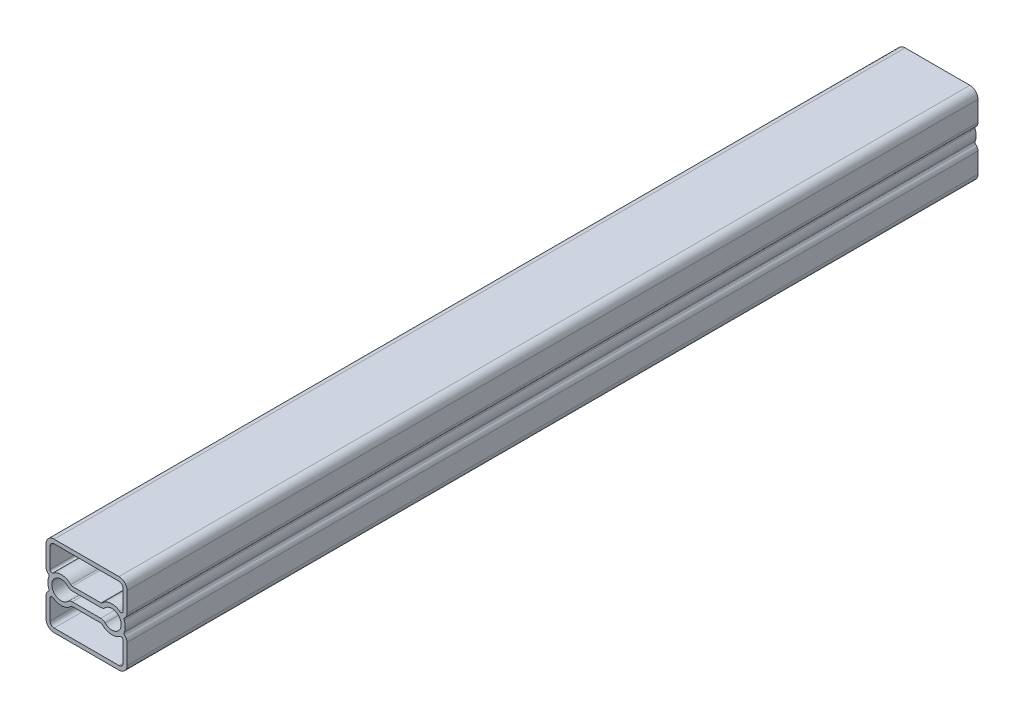
from build123d import *

# Parameters (mm, degrees)
BOSS_EXTRUDE1_DEPTH = 266.7


with BuildPart() as part:
    # Sketch1 → Boss-Extrude1 (new body)
    with BuildSketch(Plane.XY):
        with BuildLine():
            Line((12.7, 3.904831807), (12.7, 10.16))
            ThreePointArc((12.7, 10.16), (11.956051224, 11.956051224), (10.16, 12.7))
            Line((10.16, 12.7), (-10.16, 12.7))
            ThreePointArc((-10.16, 12.7), (-11.956051224, 11.956051224), (-12.7, 10.16))
            Line((-12.7, 10.16), (-12.7, 3.904831807))
            ThreePointArc((-12.7, 3.904831807), (-12.511460601, 3.078521934), (-11.983162199, 2.415773182))
            ThreePointArc((-11.983162199, 2.415773182), (-11.763134535, 2.073265365), (-11.796313868, 1.667527878))
            ThreePointArc((-11.796313868, 1.667527878), (-12.1412, 0), (-11.796313868, -1.667527878))
            ThreePointArc((-11.796313868, -1.667527878), (-11.763134535, -2.073265365), (-11.983162199, -2.415773182))
            ThreePointArc((-11.983162199, -2.415773182), (-12.511460601, -3.078521934), (-12.7, -3.904831807))
            Line((-12.7, -3.904831807), (-12.7, -10.16))
            ThreePointArc((-12.7, -10.16), (-11.956051224, -11.956051224), (-10.16, -12.7))
            Line((-10.16, -12.7), (10.16, -12.7))
            ThreePointArc((10.16, -12.7), (11.956051224, -11.956051224), (12.7, -10.16))
            Line((12.7, -10.16), (12.7, -3.904831807))
            ThreePointArc((12.7, -3.904831807), (12.511460601, -3.078521934), (11.983162199, -2.415773182))
            ThreePointArc((11.983162199, -2.415773182), (11.763134535, -2.073265365), (11.796313868, -1.667527878))
            ThreePointArc((11.796313868, -1.667527878), (12.1412, 0), (11.796313868, 1.667527878))
            ThreePointArc((11.796313868, 1.667527878), (11.763134535, 2.073265365), (11.983162199, 2.415773182))
            ThreePointArc((11.983162199, 2.415773182), (12.511460601, 3.078521934), (12.7, 3.904831807))
        make_face()
        with BuildLine():
            Line((4.467104451, -1.46685), (-4.467104451, -1.46685))
            ThreePointArc((-4.467104451, -1.46685), (-5.208770649, -1.617154514), (-5.833401911, -2.04435))
            ThreePointArc((-5.833401911, -2.04435), (-10.8712, 0), (-5.833401911, 2.04435))
            ThreePointArc((-5.833401911, 2.04435), (-5.208770649, 1.617154514), (-4.467104451, 1.46685))
            Line((-4.467104451, 1.46685), (4.467104451, 1.46685))
            ThreePointArc((4.467104451, 1.46685), (5.208770649, 1.617154514), (5.833401911, 2.04435))
            ThreePointArc((5.833401911, 2.04435), (10.8712, 0), (5.833401911, -2.04435))
            ThreePointArc((5.833401911, -2.04435), (5.208770649, -1.617154514), (4.467104451, -1.46685))
        make_face(mode=Mode.SUBTRACT)
        with BuildLine():
            Line((11.43, 10.16), (11.43, 3.904831807))
            ThreePointArc((11.43, 3.904831807), (11.082315158, 3.338550075), (10.42, 3.392386688))
            ThreePointArc((10.42, 3.392386688), (7.584682807, 4.188867833), (4.922536938, 2.92935))
            ThreePointArc((4.922536938, 2.92935), (4.714326517, 2.786951505), (4.467104451, 2.73685))
            Line((4.467104451, 2.73685), (-4.467104451, 2.73685))
            ThreePointArc((-4.467104451, 2.73685), (-4.714326517, 2.786951505), (-4.922536938, 2.92935))
            ThreePointArc((-4.922536938, 2.92935), (-7.584682807, 4.188867833), (-10.42, 3.392386688))
            ThreePointArc((-10.42, 3.392386688), (-11.082315158, 3.338550075), (-11.43, 3.904831807))
            Line((-11.43, 3.904831807), (-11.43, 10.16))
            ThreePointArc((-11.43, 10.16), (-11.058025612, 11.058025612), (-10.16, 11.43))
            Line((-10.16, 11.43), (10.16, 11.43))
            ThreePointArc((10.16, 11.43), (11.058025612, 11.058025612), (11.43, 10.16))
        make_face(mode=Mode.SUBTRACT)
        with BuildLine():
            Line((11.43, -3.904831807), (11.43, -10.16))
            ThreePointArc((11.43, -10.16), (11.058025612, -11.058025612), (10.16, -11.43))
            Line((10.16, -11.43), (-10.16, -11.43))
            ThreePointArc((-10.16, -11.43), (-11.058025612, -11.058025612), (-11.43, -10.16))
            Line((-11.43, -10.16), (-11.43, -3.904831807))
            ThreePointArc((-11.43, -3.904831807), (-11.082315158, -3.338550075), (-10.42, -3.392386688))
            ThreePointArc((-10.42, -3.392386688), (-7.584682807, -4.188867833), (-4.922536938, -2.92935))
            ThreePointArc((-4.922536938, -2.92935), (-4.714326517, -2.786951505), (-4.467104451, -2.73685))
            Line((-4.467104451, -2.73685), (4.467104451, -2.73685))
            ThreePointArc((4.467104451, -2.73685), (4.714326517, -2.786951505), (4.922536938, -2.92935))
            ThreePointArc((4.922536938, -2.92935), (7.584682807, -4.188867833), (10.42, -3.392386688))
            ThreePointArc((10.42, -3.392386688), (11.082315158, -3.338550075), (11.43, -3.904831807))
        make_face(mode=Mode.SUBTRACT)
    extrude(amount=-BOSS_EXTRUDE1_DEPTH)


solid = part.part
